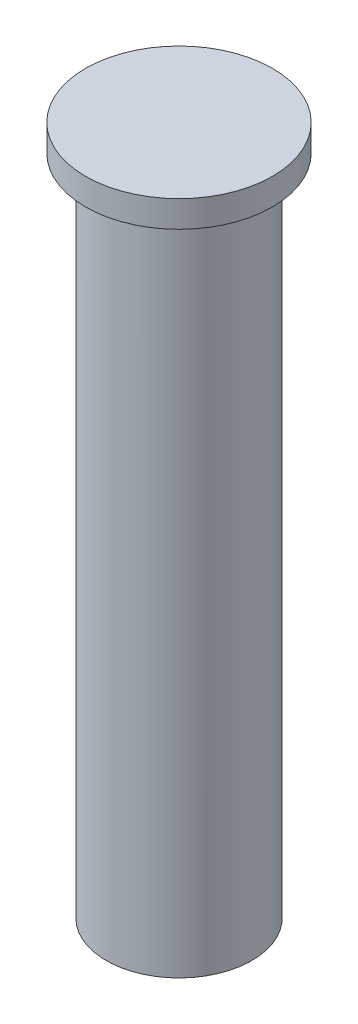
from build123d import *

# Parameters (mm, degrees)
SKETCH2_R           = 6.985
BOSS_EXTRUDE1_DEPTH = 50.8
SKETCH3_R           = 8.956914726
BOSS_EXTRUDE2_DEPTH = 2.54
BOSS_EXTRUDE3_START = 12.7
SKETCH4_R           = 6.985
BOSS_EXTRUDE3_DEPTH = 12.7


with BuildPart() as part:
    # Sketch2 → Boss-Extrude1 (new body)
    with BuildSketch(Plane(origin=(0, 0, 0), x_dir=(1, 0, 0), z_dir=(0, 1, 0))):
        with Locations(Location((0, 0, 0), (0, 0, 270))):
            Circle(SKETCH2_R)
    extrude(amount=BOSS_EXTRUDE1_DEPTH)

    # Sketch3 → Boss-Extrude2 (add)
    with BuildSketch(Plane(origin=(0, 50.8, 0), x_dir=(1, 0, 0), z_dir=(0, 1, 0))):
        with Locations(Location((0, 0, 0), (0, 0, 270))):
            Circle(SKETCH3_R)
    extrude(amount=BOSS_EXTRUDE2_DEPTH)

    # Sketch4 → Boss-Extrude3 (add)
    with BuildSketch(Plane.XZ.offset(BOSS_EXTRUDE3_START)):
        with Locations(Location((0, 0, 0), (0, 0, 270))):
            Circle(SKETCH4_R)
    extrude(amount=-BOSS_EXTRUDE3_DEPTH)


solid = part.part
